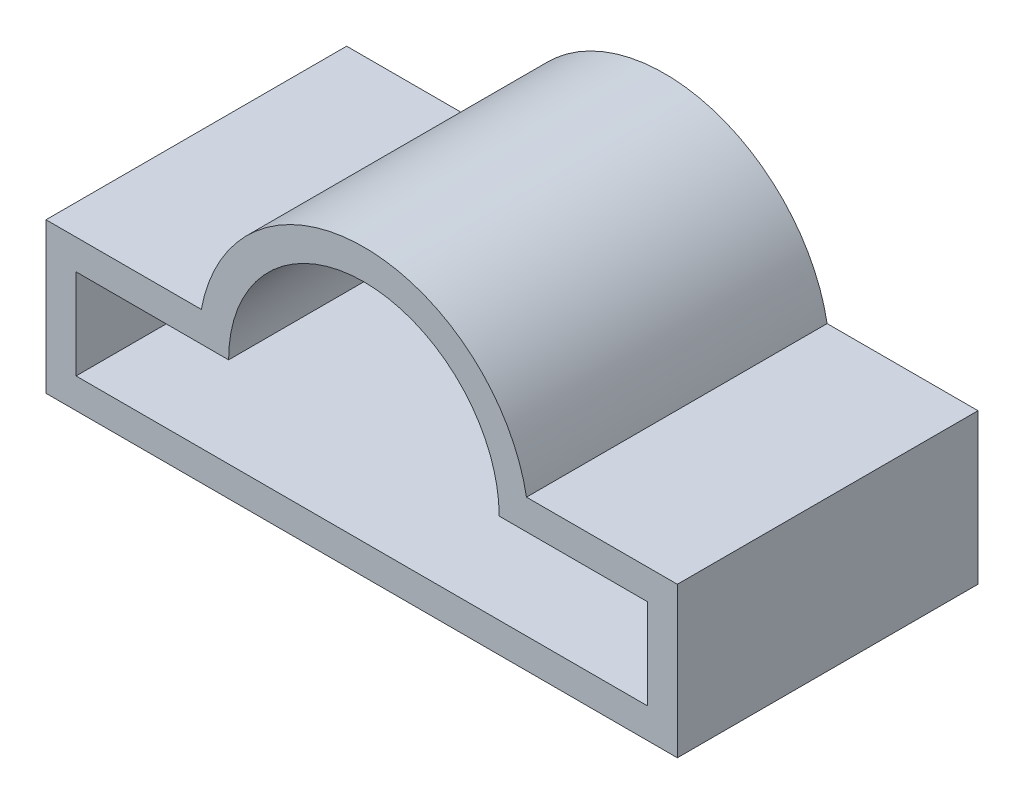
from build123d import *

# Parameters (mm, degrees)
BOSS_EXTRUDE1_DEPTH = 10


with BuildPart() as part:
    # Sketch1 → Boss-Extrude1 (new, symmetric)
    with BuildSketch(Plane.XY):
        with BuildLine():
            Line((10.816653826, 2), (20.85239712, 2))
            Line((20.85239712, 2), (20.85239712, -8))
            Line((20.85239712, -8), (-21.14760288, -8))
            Line((-21.14760288, -8), (-21.14760288, 2))
            Line((-21.14760288, 2), (-10.816653826, 2))
            ThreePointArc((-10.816653826, 2), (0, 11), (10.816653826, 2))
        make_face()
        with BuildLine():
            Line((9, 0), (18.85239712, 0))
            Line((18.85239712, 0), (18.85239712, -6))
            Line((18.85239712, -6), (-19.14760288, -6))
            Line((-19.14760288, -6), (-19.14760288, 0))
            Line((-19.14760288, 0), (-9, 0))
            ThreePointArc((-9, 0), (0, 9), (9, 0))
        make_face(mode=Mode.SUBTRACT)
    extrude(amount=BOSS_EXTRUDE1_DEPTH, both=True)


solid = part.part
